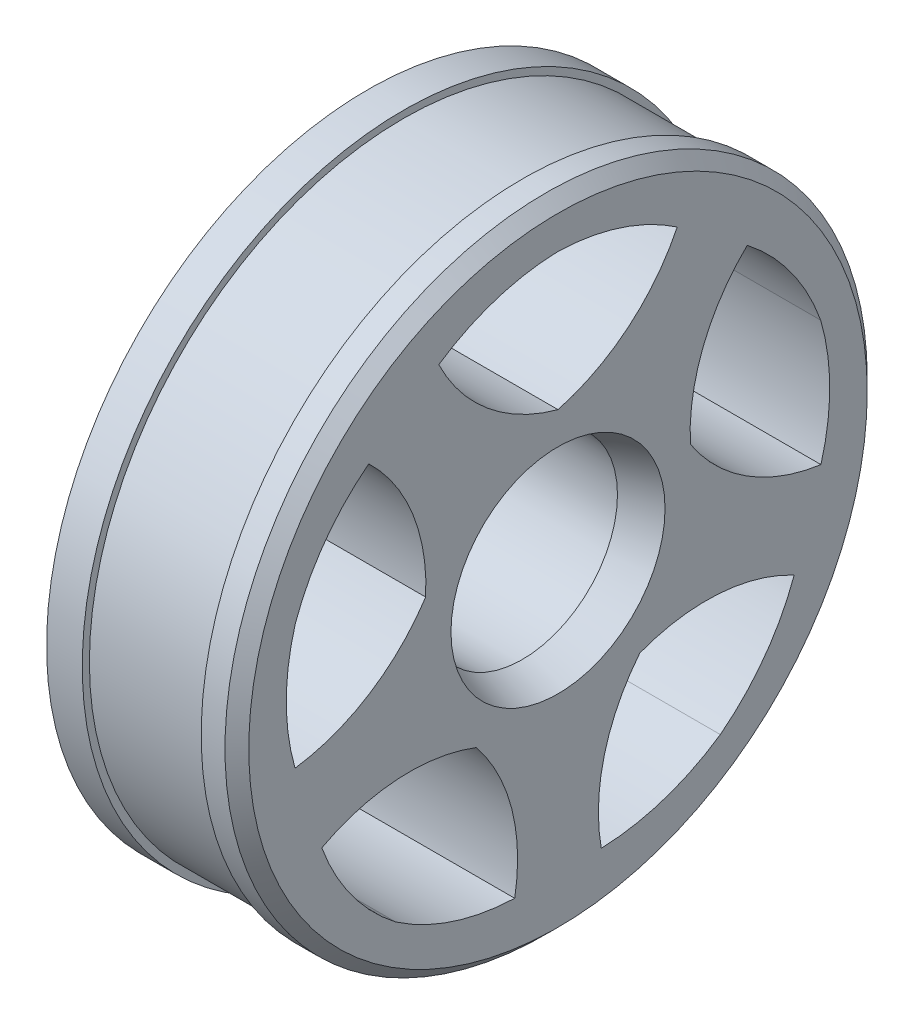
from build123d import *

# Parameters (mm, degrees)
SKETCH1_R           = 13.5
SKETCH1_R_2         = 4
BOSS_EXTRUDE1_DEPTH = 4
CUT_EXTRUDE1_DEPTH  = 20.506409203
CIRPATTERN1_COUNT   = 5
CHAMFER1_SIZE       = 0.5
SKETCH4_R           = 13.5
SKETCH4_R_2         = 13.2
CUT_EXTRUDE3_DEPTH  = 2.5
CHAMFER2_SIZE       = 0.5
CHAMFER2_SIZE2      = 1.5


with BuildPart() as part:
    # Sketch1 → Boss-Extrude1 (new, symmetric)
    with BuildSketch(Plane(origin=(0, 0, 0), x_dir=(0, 0, -1), z_dir=(1, 0, 0))):
        Circle(SKETCH1_R)
        Circle(SKETCH1_R_2, mode=Mode.SUBTRACT)
    extrude(amount=BOSS_EXTRUDE1_DEPTH, both=True)

    # Sketch2 → Cut-Extrude1 (cut, symmetric)
    with BuildSketch(Plane(origin=(0, 0, 0), x_dir=(0, 0, -1), z_dir=(1, 0, 0))):
        with BuildLine():
            ThreePointArc((0, 5.849695328), (-2.956289657, 7.377375059), (-5.012219469, 9.99397715))
            ThreePointArc((-5.012219469, 9.99397715), (-2.621563936, 11.159720287), (0, 11.6087119))
            ThreePointArc((0, 11.6087119), (2.621563936, 11.159720287), (5.012219469, 9.99397715))
            ThreePointArc((5.012219469, 9.99397715), (2.956289657, 7.377375059), (0, 5.849695328))
        make_face()
    cut_extrude1 = extrude(amount=CUT_EXTRUDE1_DEPTH, both=True, mode=Mode.SUBTRACT)

    # CirPattern1: Cut-Extrude1 ×5 about axis
    cirpattern1_axis = Axis((0, 0, 0), (1, 0, 0))
    for i in range(1, CIRPATTERN1_COUNT):
        add(cut_extrude1.rotate(cirpattern1_axis, i * 360 / CIRPATTERN1_COUNT), mode=Mode.SUBTRACT)

    # Chamfer1
    chamfer1_edges = [part.edges().sort_by_distance(p)[0] for p in [
        (4, 0, 13.5),
    ]]
    chamfer(chamfer1_edges, length=CHAMFER1_SIZE)

    # Sketch4 → Cut-Extrude3 (cut, symmetric)
    with BuildSketch(Plane(origin=(0, 0, 0), x_dir=(0, 0, -1), z_dir=(1, 0, 0))):
        Circle(SKETCH4_R)
        Circle(SKETCH4_R_2, mode=Mode.SUBTRACT)
    extrude(amount=CUT_EXTRUDE3_DEPTH, both=True, mode=Mode.SUBTRACT)

    # Chamfer2
    chamfer2_edges = [part.edges().sort_by_distance(p)[0] for p in [
        (4, 0, 4),
    ]]
    chamfer2_side = [part.faces().sort_by_distance(p)[0] for p in [
        (4, 0, 12.632304474),
    ]]
    chamfer(chamfer2_edges, length=CHAMFER2_SIZE, length2=CHAMFER2_SIZE2, reference=chamfer2_side[0])


solid = part.part
